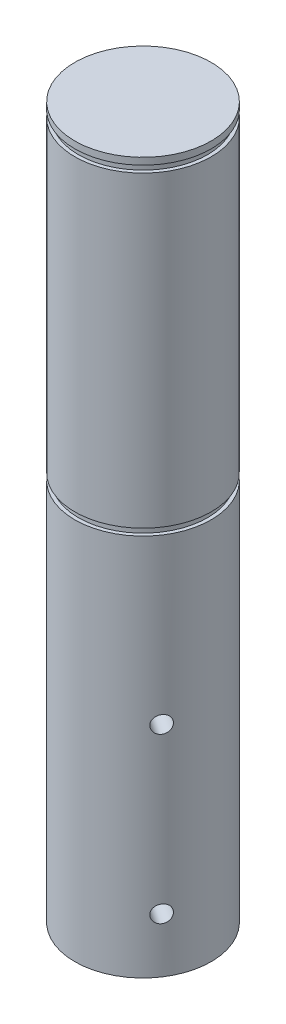
from build123d import *

# Parameters (mm, degrees)
SKETCH_1_R        = 9.975
EXTRUDE_1_DEPTH   = 40
SKETCH_5_R        = 9.975
F_16MM_DEPTH      = 16
SKETCH_6_R        = 9.45
EXTRUDE_1_2_DEPTH = 1
SKETCH_7_R        = 9.975
EXTRUDE_4_DEPTH   = 45
SKETCH_8_R        = 9.45
EXTRUDE_2_DEPTH   = 1
SKETCH_9_R        = 9.975
EXTRUDE_6_DEPTH   = 1


with BuildPart() as part:
    # 草图1 → Extrude 1 (new body)
    with BuildSketch(Plane(origin=(0, 0, 0), x_dir=(1, 0, 0), z_dir=(0, 1, 0))):
        with Locations(Location((5.9, 0, 0), (0, 0, 270))):
            Circle(SKETCH_1_R)
    extrude(amount=EXTRUDE_1_DEPTH)

    # 草图4 → M3 螺纹孔2 (revolve, cut)
    with BuildSketch(Plane(origin=(14.191283323, 8, 5.545741236), x_dir=(0.555964033642643, 0, -0.8312063482047055), z_dir=(0, 1, 0))):
        Polygon((0, 0), (0, 9.251075774), (1.25, 8.5), (1.25, 0), align=None)
    hole_wizard_m3_2 = revolve(axis=Axis((19.469443634, 8, 9.076112849), (-0.8312063482047054, 0, -0.555964033642643)), mode=Mode.SUBTRACT)

    # Mirror 1364: M3 螺纹孔2 across plane
    add(hole_wizard_m3_2.mirror(Plane(origin=(0, 20, 0), x_dir=(0, 0, 1), z_dir=(0, -1, 0))), mode=Mode.SUBTRACT)

    # 草图5 → 16mm 铰链间距 (add)
    with BuildSketch(Plane(origin=(0, 40, 0), x_dir=(1, 0, 0), z_dir=(0, 1, 0))):
        with Locations(Location((5.9, 0, 0), (0, 0, 270))):
            Circle(SKETCH_5_R)
    extrude(amount=F_16MM_DEPTH)

    # 草图6 → Extrude 1 2 (add)
    with BuildSketch(Plane(origin=(0, 56, 0), x_dir=(1, 0, 0), z_dir=(0, 1, 0))):
        with Locations(Location((5.9, 0, 0), (0, 0, 270))):
            Circle(SKETCH_6_R)
    extrude(amount=EXTRUDE_1_2_DEPTH)

    # 草图7 → 凸台-拉伸4 (add)
    with BuildSketch(Plane(origin=(0, 57, 0), x_dir=(1, 0, 0), z_dir=(0, 1, 0))):
        with Locations(Location((5.9, 0, 0), (0, 0, 270))):
            Circle(SKETCH_7_R)
    extrude(amount=EXTRUDE_4_DEPTH)

    # 草图8 → 卡簧2 (add)
    with BuildSketch(Plane(origin=(0, 102, 0), x_dir=(1, 0, 0), z_dir=(0, 1, 0))):
        with Locations(Location((5.9, 0, 0), (0, 0, 270))):
            Circle(SKETCH_8_R)
    extrude(amount=EXTRUDE_2_DEPTH)

    # 草图9 → 凸台-拉伸6 (add)
    with BuildSketch(Plane(origin=(0, 103, 0), x_dir=(1, 0, 0), z_dir=(0, 1, 0))):
        with Locations(Location((5.9, 0, 0), (0, 0, 270))):
            Circle(SKETCH_9_R)
    extrude(amount=EXTRUDE_6_DEPTH)


solid = part.part
